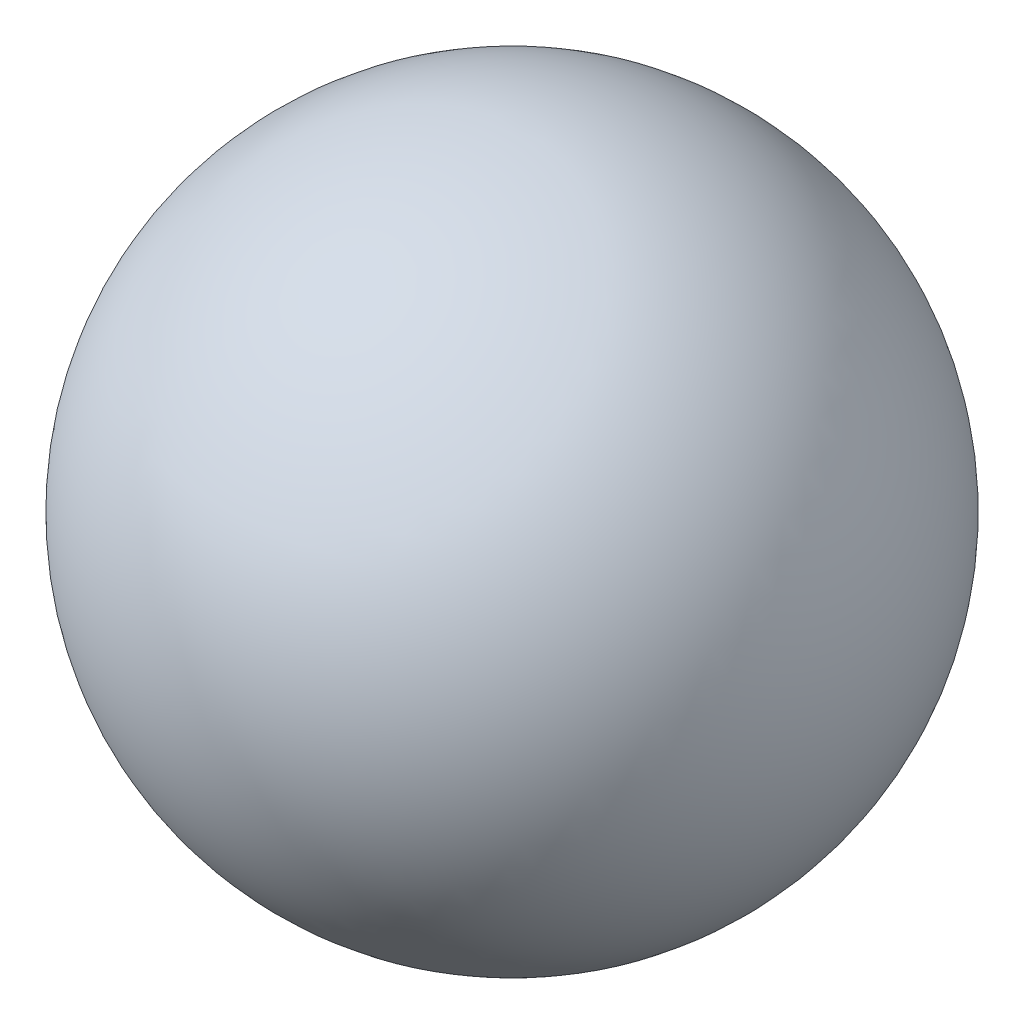
from build123d import *


with BuildPart() as part:
    # Sketch1 → Revolve1 (revolve)
    with BuildSketch(Plane.XY):
        with BuildLine():
            Line((0, 165.1), (0, 162.306))
            ThreePointArc((0, 162.306), (162.306, 0), (0, -162.306))
            Line((0, -162.306), (0, -165.1))
            ThreePointArc((0, -165.1), (165.1, 0), (0, 165.1))
        make_face()
    revolve(axis=Axis((0, 165.1, 0), (0, -1, 0)))


solid = part.part
